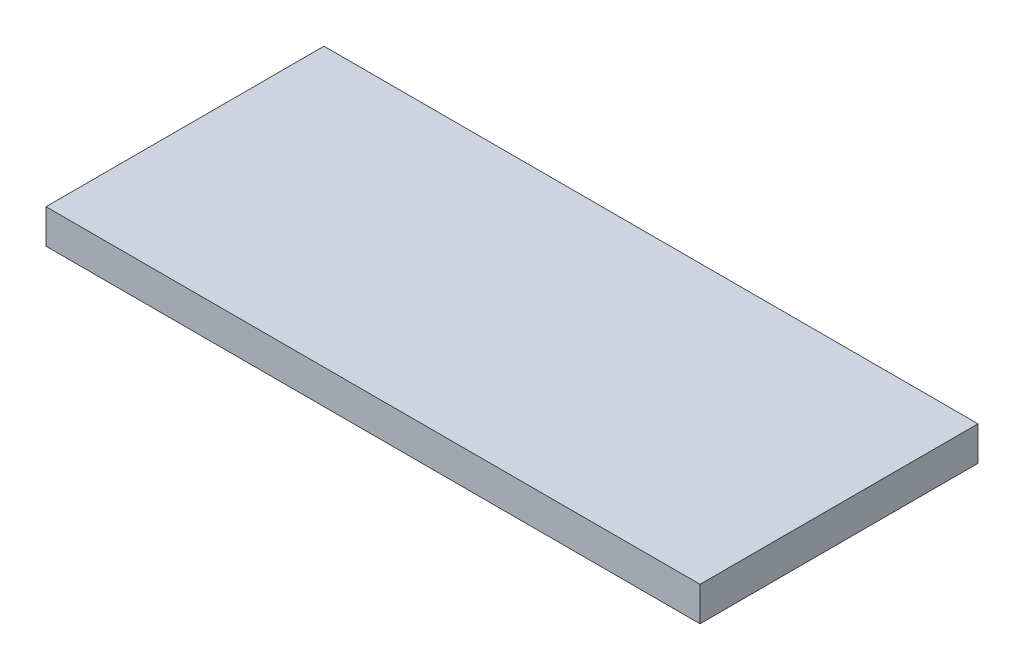
from build123d import *

# Parameters (mm, degrees)
SKETCH1_W           = 59.76
SKETCH1_H           = 25.4
BOSS_EXTRUDE1_DEPTH = 3.125


with BuildPart() as part:
    # Sketch1 → Boss-Extrude1 (new body)
    with BuildSketch(Plane(origin=(0, 0, 0), x_dir=(1, 0, 0), z_dir=(0, 1, 0))):
        with Locations((29.88, 12.7)):
            Rectangle(SKETCH1_W, SKETCH1_H)
    extrude(amount=BOSS_EXTRUDE1_DEPTH)


solid = part.part
